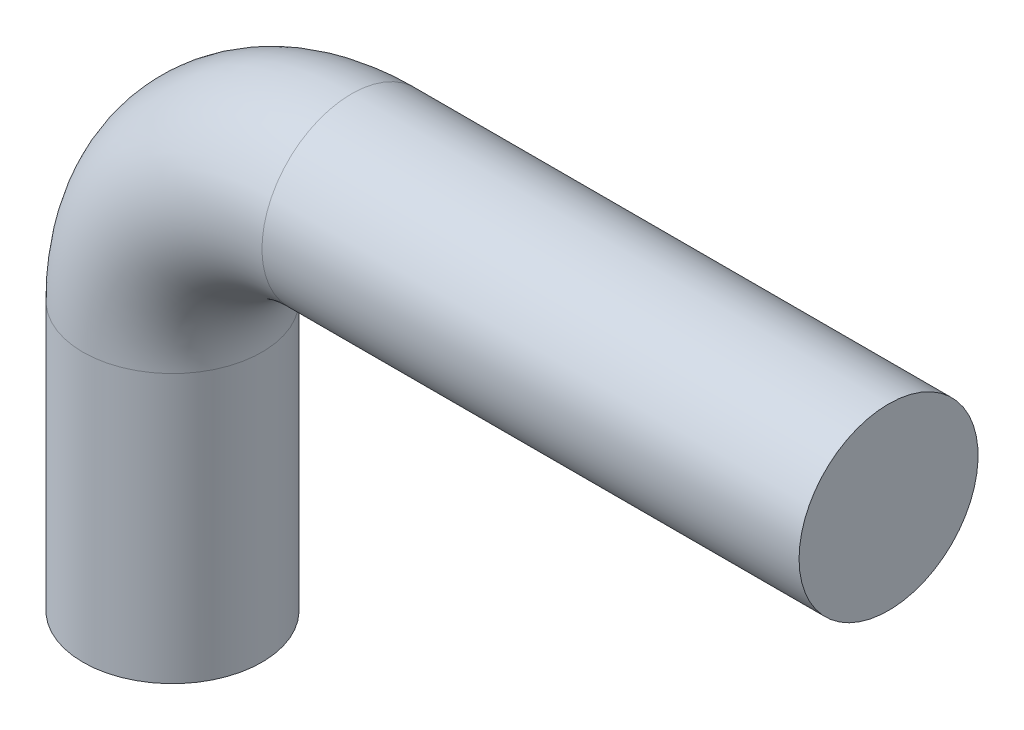
from build123d import *

# Parameters (mm, degrees)
SWEEP1_PROFILE_R = 5


with BuildPart() as part:
    # Sweep1: sweep along a path in Sketch1
    with BuildLine(Plane.XY) as sweep1_path:
        Line((0, 0), (0, 15))
        ThreePointArc((0, 15), (2.928932188, 22.071067812), (10, 25))
        Line((10, 25), (40, 25))
    # Sweep1 profile (on start of the path) → Sweep1 (sweep)
    with BuildSketch(Plane.ZX):
        Circle(SWEEP1_PROFILE_R)
    sweep(path=sweep1_path.line)


solid = part.part
